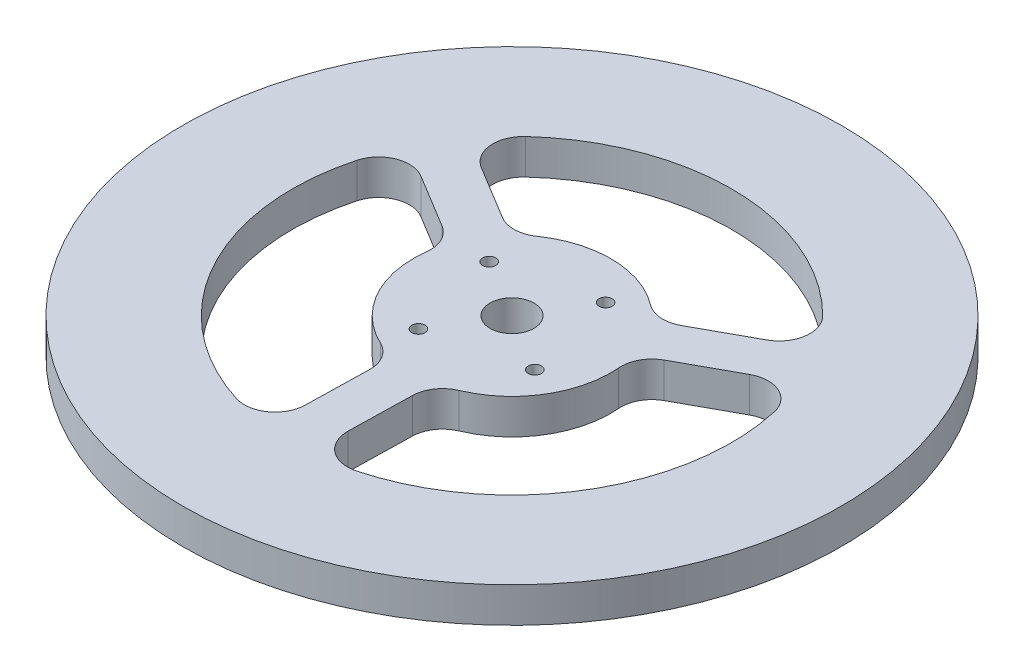
from build123d import *

# Parameters (mm, degrees)
SKETCH_1_R          = 75
EXTRUDE_1_DEPTH     = 8
FILLET_1_R          = 7
FILLET_2_R          = 7
FILLET_3_R          = 7
SKETCH_2_R          = 5
CUT_EXTRUDE_1_DEPTH = 10
SKETCH_3_R          = 1.5
CUT_EXTRUDE_2_DEPTH = 10
FILLET_4_R          = 7


with BuildPart() as part:
    # 草图1 → 凸台-拉伸1 (new body)
    with BuildSketch(Plane(origin=(0, 0, 0), x_dir=(1, 0, 0), z_dir=(0, 1, 0))):
        with Locations(Location((0, 0, 0), (0, 0, 270))):
            Circle(SKETCH_1_R)
        with BuildLine():
            Line((-5.48403898, -21.821441668), (-6.099248264, -49.626597411))
            ThreePointArc((-6.099248264, -49.626597411), (-43.843682887, -24.036045242), (-45.11861404, 21.547869201))
            Line((-45.11861404, 21.547869201), (-21.346247453, 7.11250446))
            ThreePointArc((-21.346247453, 7.11250446), (-19.729657299, -10.816220359), (-5.48403898, -21.821441668))
        make_face(mode=Mode.SUBTRACT)
        with BuildLine():
            Line((-39.928269929, 30.095402646), (-16.155903342, 15.660037906))
            ThreePointArc((-16.155903342, 15.660037906), (0.497707046, 22.494494609), (16.832733273, 14.930140339))
            Line((16.832733273, 14.930140339), (41.220309145, 28.299931342))
            ThreePointArc((41.220309145, 28.299931342), (1.106015658, 49.987765797), (-39.928269929, 30.095402646))
        make_face(mode=Mode.SUBTRACT)
        with BuildLine():
            Line((4.513514179, -22.042644799), (3.898304895, -49.847800543))
            ThreePointArc((3.898304895, -49.847800543), (42.73766723, -25.951720555), (46.027518194, 19.531194765))
            Line((46.027518194, 19.531194765), (21.639942322, 6.161403762))
            ThreePointArc((21.639942322, 6.161403762), (19.231950253, -11.67827425), (4.513514179, -22.042644799))
        make_face(mode=Mode.SUBTRACT)
    extrude(amount=EXTRUDE_1_DEPTH)

    # 圆角1
    fillet_1_edges = [part.edges().sort_by_distance(p)[0] for p in [
        (41.220309145, 4, -28.299931342),
    ]]
    fillet(fillet_1_edges, radius=FILLET_1_R)

    # 圆角2
    fillet_2_edges = [part.edges().sort_by_distance(p)[0] for p in [
        (-39.928269929, 4, -30.095402646),
    ]]
    fillet(fillet_2_edges, radius=FILLET_2_R)

    # 圆角3
    fillet_3_edges = [part.edges().sort_by_distance(p)[0] for p in [
        (3.898304895, 4, 49.847800543),
        (46.027518194, 4, -19.531194765),
        (-45.11861404, 4, -21.547869201),
        (-6.099248264, 4, 49.626597411),
    ]]
    fillet(fillet_3_edges, radius=FILLET_3_R)

    # 草图2 → 切除-拉伸1 (cut)
    with BuildSketch(Plane(origin=(0, 8, 0), x_dir=(1, 0, 0), z_dir=(0, 1, 0))):
        with Locations(Location((0, 0, 0), (0, 0, 270))):
            Circle(SKETCH_2_R)
    extrude(amount=-CUT_EXTRUDE_1_DEPTH, mode=Mode.SUBTRACT)

    # 草图3 → 切除-拉伸2 (cut)
    with BuildSketch(Plane(origin=(0, 8, 0), x_dir=(1, 0, 0), z_dir=(0, 1, 0))):
        with Locations(Location((-13.248676841, 8.045033372, 0), (0, 0, 270))):
            Circle(SKETCH_3_R)
        with Locations(Location((8.045033372, 13.248676841, 0), (0, 0, 270))):
            Circle(SKETCH_3_R)
        with Locations(Location((13.248676841, -8.045033372, 0), (0, 0, 270))):
            Circle(SKETCH_3_R)
        with Locations(Location((-8.045033372, -13.248676841, 0), (0, 0, 270))):
            Circle(SKETCH_3_R)
    extrude(amount=-CUT_EXTRUDE_2_DEPTH, mode=Mode.SUBTRACT)

    # 圆角4
    fillet_4_edges = [part.edges().sort_by_distance(p)[0] for p in [
        (-16.155903342, 4, -15.660037906),
        (16.832733273, 4, -14.930140339),
        (21.639942322, 4, -6.161403762),
        (4.513514179, 4, 22.042644799),
        (-5.48403898, 4, 21.821441668),
        (-21.346247453, 4, -7.11250446),
    ]]
    fillet(fillet_4_edges, radius=FILLET_4_R)


solid = part.part
